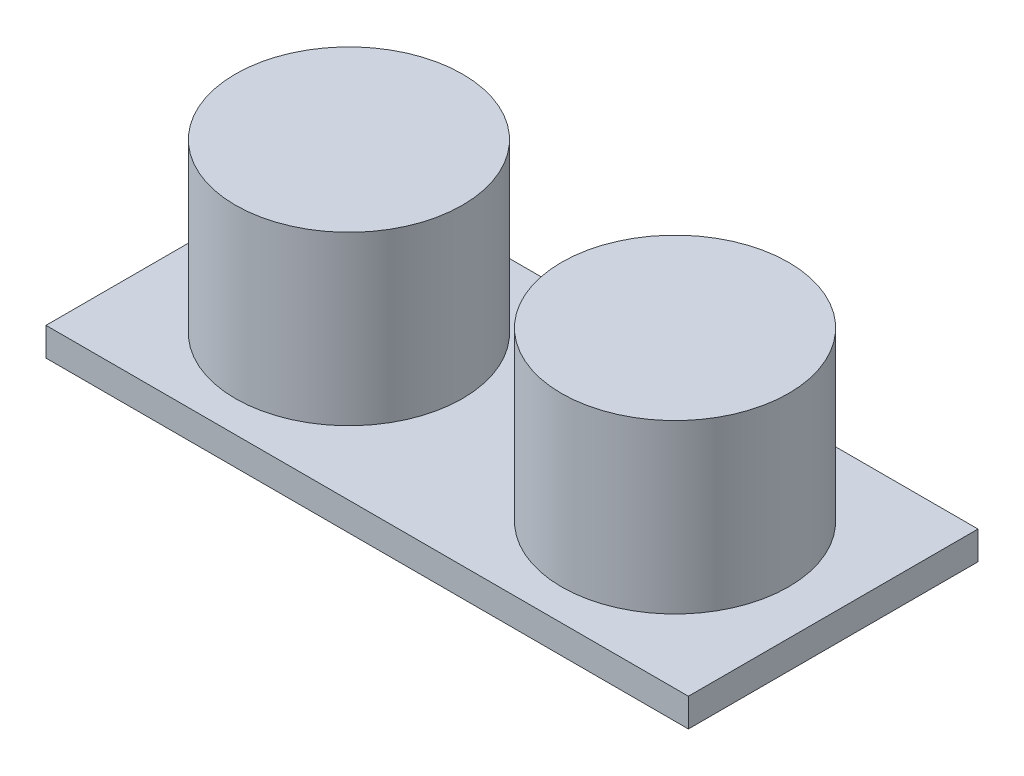
from build123d import *

# Parameters (mm, degrees)
CROQUIS1_W              = 45.25
CROQUIS1_H              = 20.4
CROQUIS1_R              = 8
SALIENTE_EXTRUIR1_DEPTH = 2
CROQUIS2_R              = 8
SALIENTE_EXTRUIR2_DEPTH = 13.8
CROQUIS3_W              = 10.45
CROQUIS3_H              = 2.5
SALIENTE_EXTRUIR4_DEPTH = 4.3
CROQUIS4_W              = 10.45
CROQUIS4_H              = 2
SALIENTE_EXTRUIR5_DEPTH = 6.4


with BuildPart() as part:
    # Croquis1 → Saliente-Extruir1 (new body)
    with BuildSketch(Plane(origin=(0, 0, 0), x_dir=(1, 0, 0), z_dir=(0, 1, 0))):
        with Locations((1.264210019, -2.135211946)):
            Rectangle(CROQUIS1_W, CROQUIS1_H)
        with Locations(Location((-10.222061657, -2.135211946, 0), (0, 0, 270))):
            Circle(CROQUIS1_R, mode=Mode.SUBTRACT)
        with Locations(Location((12.749210019, -2.135211946, 0), (0, 0, 270))):
            Circle(CROQUIS1_R, mode=Mode.SUBTRACT)
    extrude(amount=SALIENTE_EXTRUIR1_DEPTH)

    # Croquis2 → Saliente-Extruir2 (add)
    with BuildSketch(Plane(origin=(0, 0, 0), x_dir=(-1, 0, 0), z_dir=(0, -1, 0))):
        with Locations(Location((10.222061657, -2.135211946, 0), (0, 0, 90))):
            Circle(CROQUIS2_R)
        with Locations(Location((-12.749210019, -2.135211946, 0), (0, 0, 90))):
            Circle(CROQUIS2_R)
    extrude(amount=-SALIENTE_EXTRUIR2_DEPTH)

    # Croquis3 → Saliente-Extruir4 (add)
    with BuildSketch(Plane(origin=(0, 0, 0), x_dir=(-1, 0, 0), z_dir=(0, -1, 0))):
        with Locations((-1.264210019, 6.814788054)):
            Rectangle(CROQUIS3_W, CROQUIS3_H)
    extrude(amount=SALIENTE_EXTRUIR4_DEPTH)

    # Croquis4 → Saliente-Extruir5 (add)
    with BuildSketch(Plane(origin=(0, 0, -8.064788054), x_dir=(-1, 0, 0), z_dir=(0, 0, -1))):
        with Locations((-1.264210019, -3.3)):
            Rectangle(CROQUIS4_W, CROQUIS4_H)
    extrude(amount=SALIENTE_EXTRUIR5_DEPTH)


solid = part.part
